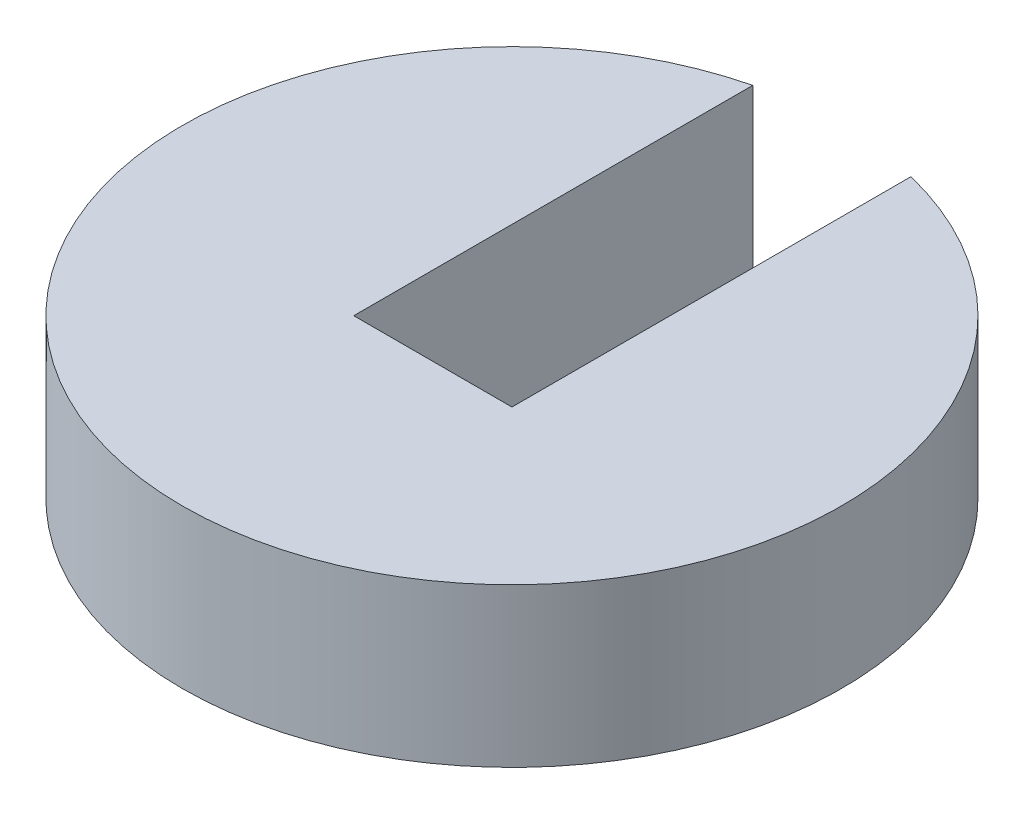
from build123d import *

# Parameters (mm, degrees)
RESSALTO_EXTRUS_O1_DEPTH = 6


with BuildPart() as part:
    # Esboço1 → Ressalto-extrusão1 (new body)
    with BuildSketch(Plane(origin=(0, 0, 0), x_dir=(1, 0, 0), z_dir=(0, 1, 0))):
        with BuildLine():
            Line((-3, 12.1346611), (-3, -3))
            Line((-3, -3), (3, -3))
            Line((3, -3), (3, 12.1346611))
            ThreePointArc((3, 12.1346611), (0, -12.5), (-3, 12.1346611))
        make_face()
    extrude(amount=RESSALTO_EXTRUS_O1_DEPTH)


solid = part.part
